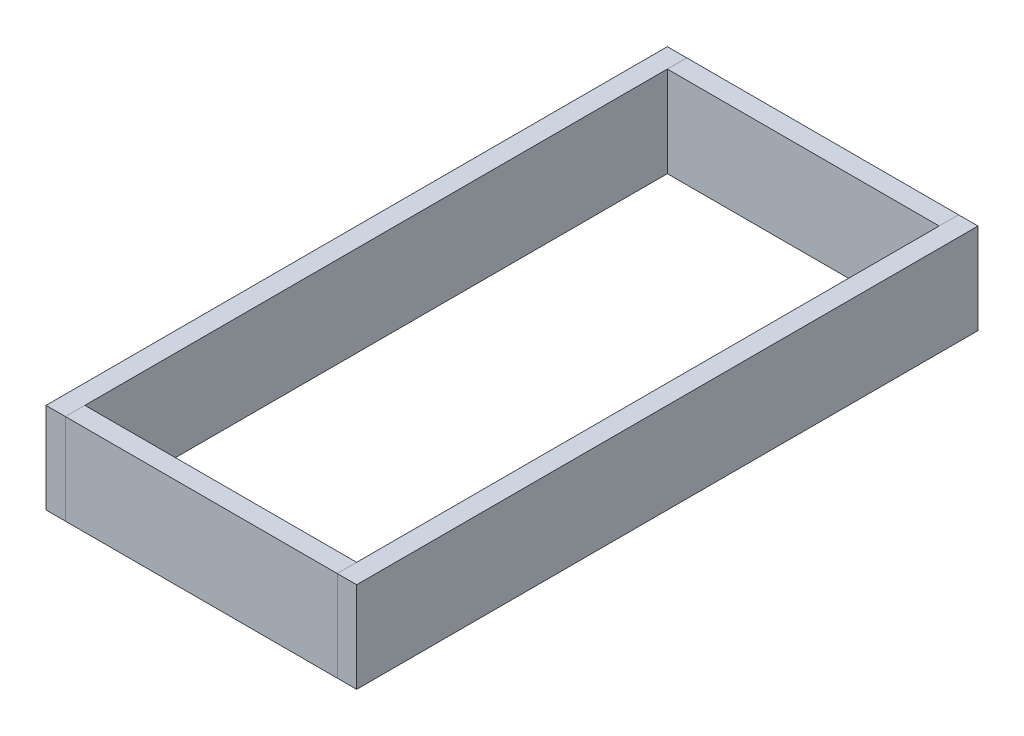
from build123d import *

# Parameters (mm, degrees)
SKETCH1_W             = 19.05
SKETCH1_H             = 609.6
BOSS_EXTRUDE1_DEPTH   = 88.9
BOSS_EXTRUDE1_2_DEPTH = 88.9
SKETCH1_5_W           = 266.7
SKETCH1_5_H           = 19.05
BOSS_EXTRUDE2_DEPTH   = 88.9
BOSS_EXTRUDE2_2_DEPTH = 88.9


with BuildPart() as part:
    # Sketch1 → Boss-Extrude1 (new body)
    with BuildSketch(Plane(origin=(0, 0, 0), x_dir=(1, 0, 0), z_dir=(0, 1, 0))):
        with Locations((-142.875, 0)):
            Rectangle(SKETCH1_W, SKETCH1_H)
    extrude(amount=BOSS_EXTRUDE1_DEPTH)


with BuildPart() as body_2:
    # Sketch1 → Boss-Extrude1 2 (new body)
    with BuildSketch(Plane(origin=(0, 0, 0), x_dir=(1, 0, 0), z_dir=(0, 1, 0))):
        with Locations((142.875, 0)):
            Rectangle(SKETCH1_W, SKETCH1_H)
    extrude(amount=BOSS_EXTRUDE1_2_DEPTH)


with BuildPart() as body_3:
    # Sketch1<5> → Boss-Extrude2 (new body)
    with BuildSketch(Plane(origin=(0, 0, 0), x_dir=(1, 0, 0), z_dir=(0, 1, 0))):
        with Locations((0, 295.275)):
            Rectangle(SKETCH1_5_W, SKETCH1_5_H)
    extrude(amount=BOSS_EXTRUDE2_DEPTH)


with BuildPart() as body_4:
    # Sketch1<5> → Boss-Extrude2 2 (new body)
    with BuildSketch(Plane(origin=(0, 0, 0), x_dir=(1, 0, 0), z_dir=(0, 1, 0))):
        with Locations((0, -295.275)):
            Rectangle(SKETCH1_5_W, SKETCH1_5_H)
    extrude(amount=BOSS_EXTRUDE2_2_DEPTH)


solid = Compound([part.part, body_2.part, body_3.part, body_4.part])
